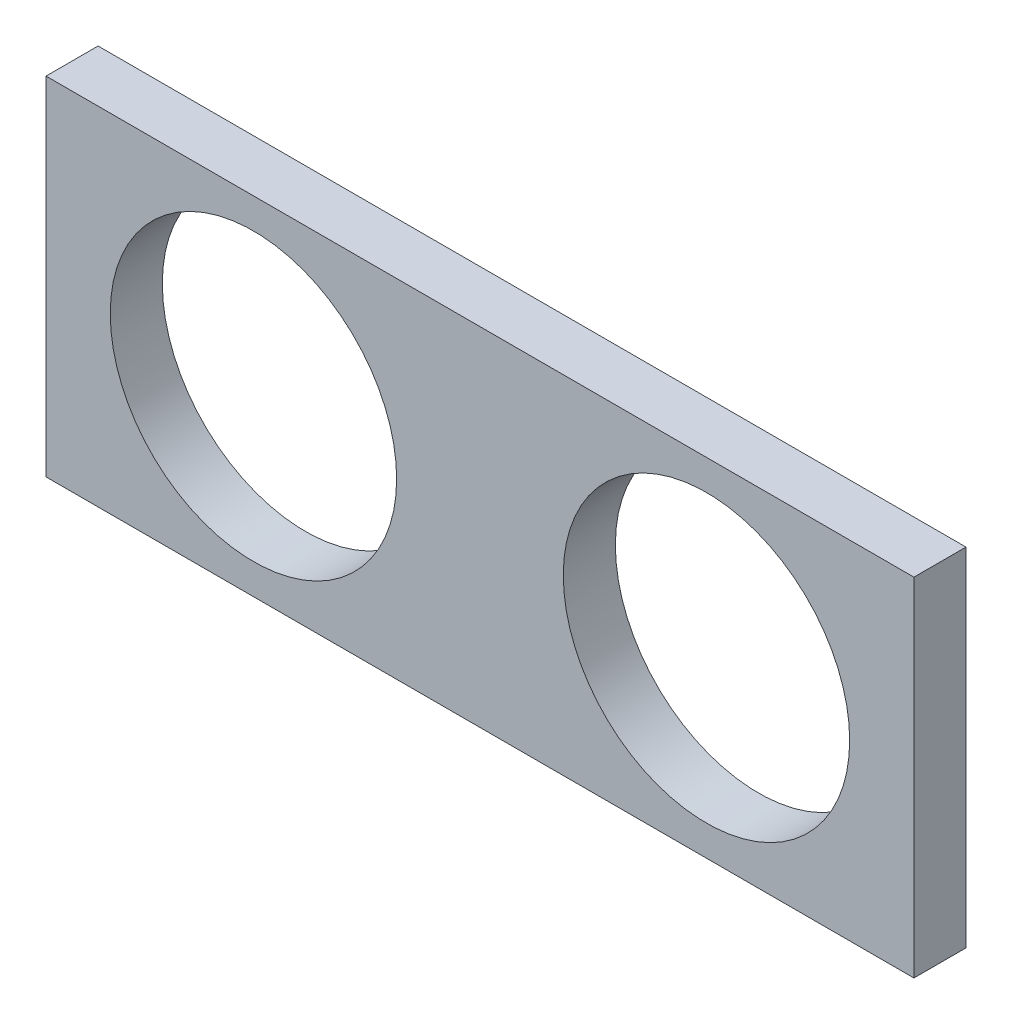
from build123d import *

# Parameters (mm, degrees)
SKETCH_1_W      = 50
SKETCH_1_H      = 20
SKETCH_1_R      = 8.25
EXTRUDE_1_DEPTH = 3


with BuildPart() as part:
    # 草图1 → 凸台-拉伸1 (new body)
    with BuildSketch(Plane.XY):
        Rectangle(SKETCH_1_W, SKETCH_1_H)
        with Locations((-13.05, 0)):
            Circle(SKETCH_1_R, mode=Mode.SUBTRACT)
        with Locations((13.05, 0)):
            Circle(SKETCH_1_R, mode=Mode.SUBTRACT)
    extrude(amount=EXTRUDE_1_DEPTH)


solid = part.part
